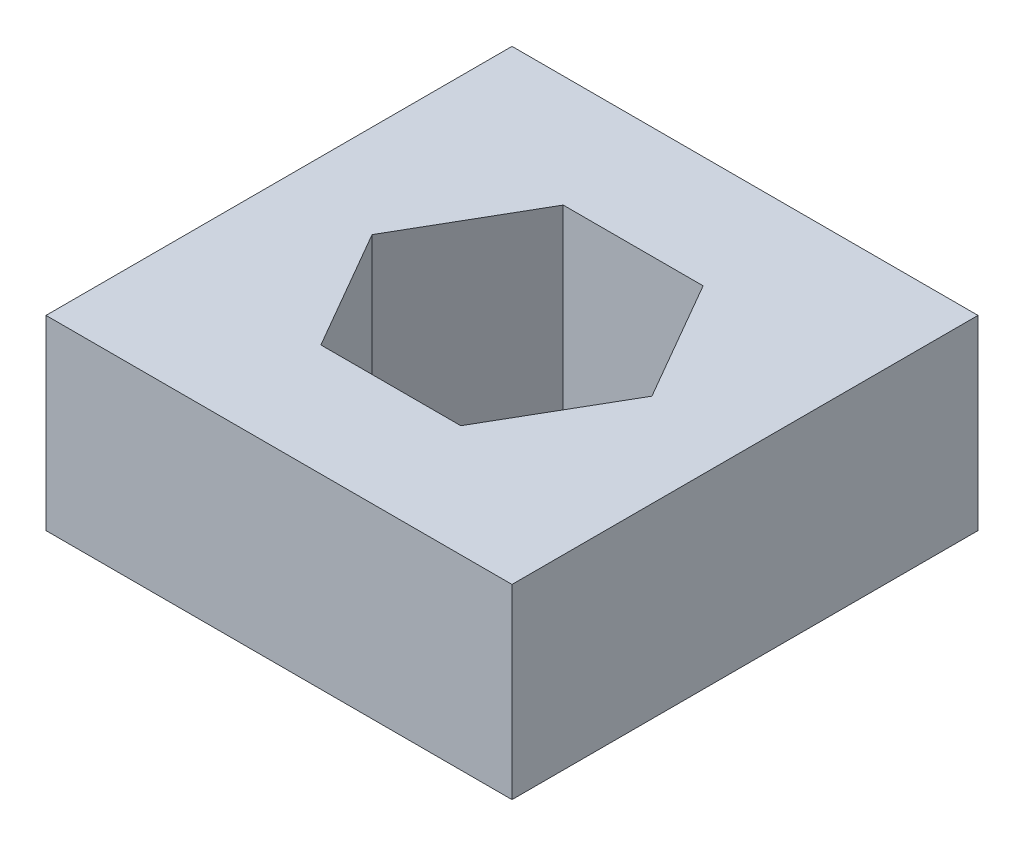
from build123d import *

# Parameters (mm, degrees)
CROQUIS1_W              = 5
CROQUIS1_H              = 5
SALIENTE_EXTRUIR1_DEPTH = 2


with BuildPart() as part:
    # Croquis1 → Saliente-Extruir1 (new body)
    with BuildSketch(Plane(origin=(0, 0, 0), x_dir=(1, 0, 0), z_dir=(0, 1, 0))):
        with Locations((0.30669145, -0.743494424)):
            Rectangle(CROQUIS1_W, CROQUIS1_H)
        Polygon((1.80780215, -0.743494424), (1.0572468, 0.556505576), (-0.4438639, 0.556505576), (-1.19441925, -0.743494424), (-0.4438639, -2.043494424), (1.0572468, -2.043494424), align=None, mode=Mode.SUBTRACT)
    extrude(amount=SALIENTE_EXTRUIR1_DEPTH)


solid = part.part
